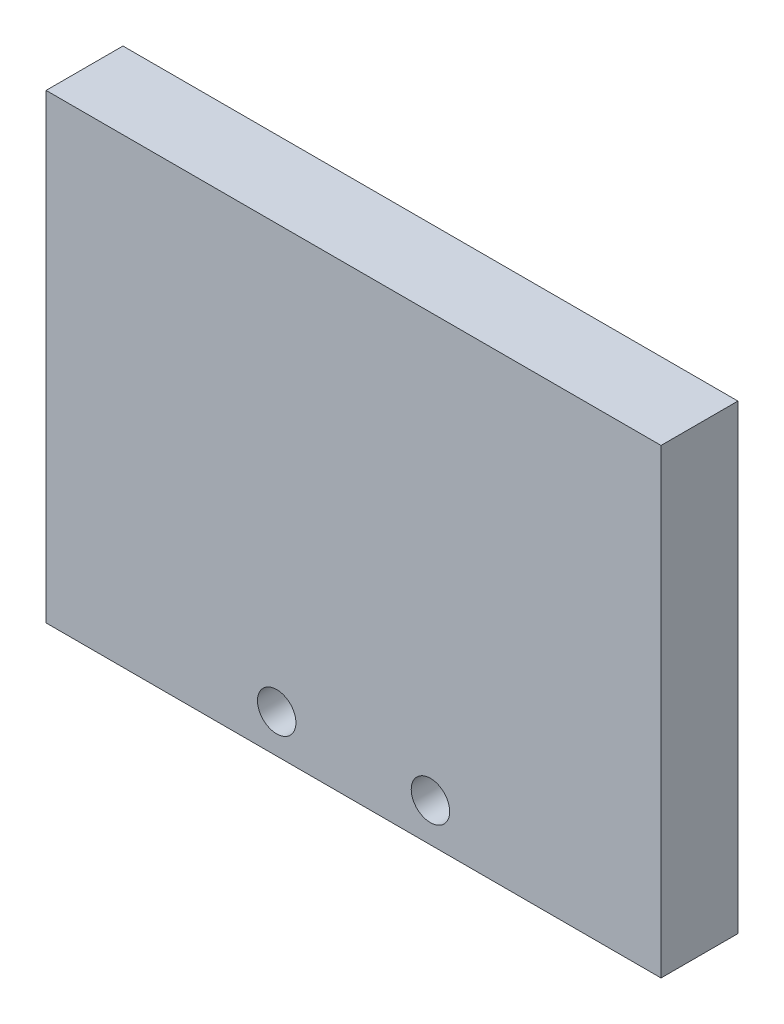
from build123d import *

# Parameters (mm, degrees)
SKETCH1_W           = 80
SKETCH1_H           = 60
BOSS_EXTRUDE1_DEPTH = 10
SKETCH2_R           = 2.5
CUT_EXTRUDE1_DEPTH  = 10


with BuildPart() as part:
    # Sketch1 → Boss-Extrude1 (new body)
    with BuildSketch(Plane.XY):
        with Locations((-17.585106489, -10.186111626)):
            Rectangle(SKETCH1_W, SKETCH1_H)
    extrude(amount=BOSS_EXTRUDE1_DEPTH)

    # Sketch2 → Cut-Extrude1 (cut)
    with BuildSketch(Plane.XY.offset(10)):
        with Locations((-27.585106489, -35.186111626)):
            Circle(SKETCH2_R)
        with Locations(Location((-7.585106489, -35.186111626, 0), (0, 0, 180))):
            Circle(SKETCH2_R)
    extrude(amount=-CUT_EXTRUDE1_DEPTH, mode=Mode.SUBTRACT)


solid = part.part
